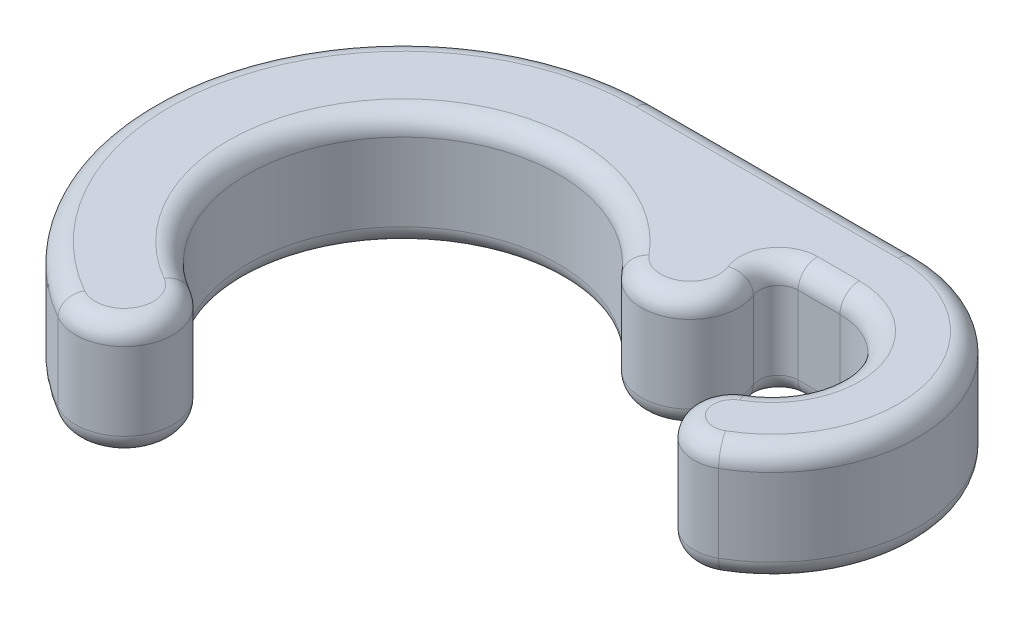
from build123d import *

# Parameters (mm, degrees)
BOSS_EXTRUDE1_DEPTH = 3
FILLET1_R           = 0.5
FILLET2_R           = 0.5


with BuildPart() as part:
    # Sketch1 → Boss-Extrude1 (new body)
    with BuildSketch(Plane(origin=(0, 0, 0), x_dir=(1, 0, 0), z_dir=(0, 1, 0))):
        with BuildLine():
            Line((6.75, 4.5), (4.69041576, 4.5))
            ThreePointArc((4.69041576, 4.5), (4.856129901, 4.320648376), (5.014990498, 4.135198944))
            ThreePointArc((5.014990498, 4.135198944), (4.845799815, 2.375547128), (3.086147999, 2.544737811))
            ThreePointArc((3.086147999, 2.544737811), (-3.053107791, 2.584285746), (-2, -3.464101615))
            ThreePointArc((-2, -3.464101615), (-1.542468245, -5.17163337), (-3.25, -5.629165125))
            ThreePointArc((-3.25, -5.629165125), (-6.278517871, 1.682323793), (0, 6.5))
            Line((0, 6.5), (6.75, 6.5))
            ThreePointArc((6.75, 6.5), (10.372221849, 3.720571419), (8.625, -0.497595264))
            ThreePointArc((8.625, -0.497595264), (7.258974596, -0.13156986), (7.625, 1.234455543))
            ThreePointArc((7.625, 1.234455543), (8.440370196, 3.202933329), (6.75, 4.5))
        make_face()
    extrude(amount=BOSS_EXTRUDE1_DEPTH)

    # Fillet1
    fillet1_edges = [part.edges().sort_by_distance(p)[0] for p in [
        (4.69041576, 1.5, -4.5),
    ]]
    fillet(fillet1_edges, radius=FILLET1_R)

    # Fillet2
    fillet2_edges = [part.edges().sort_by_distance(p)[0] for p in [
        (-6.278517871, 0, -1.682323793),
        (3.375, 0, -6.5),
        (10.372221849, 0, -3.720571419),
        (7.258974596, 0, 0.13156986),
        (8.440370196, 0, -3.202933329),
        (4.691239473, 0, -2.266636339),
        (8.440370196, 3, -3.202933329),
        (7.258974596, 3, 0.13156986),
        (10.372221849, 3, -3.720571419),
        (3.375, 3, -6.5),
        (-6.278517871, 3, -1.682323793),
        (-1.542468245, 3, 5.17163337),
        (6.210663896, 0, -4.5),
        (6.210663896, 3, -4.5),
        (5.256424049, 0, -4.279024881),
        (5.256424049, 3, -4.279024881),
        (-3.053107791, 3, -2.584285746),
        (4.691239473, 3, -2.266636339),
        (-3.053107791, 0, -2.584285746),
        (-1.542468245, 0, 5.17163337),
    ]]
    fillet(fillet2_edges, radius=FILLET2_R)


solid = part.part
